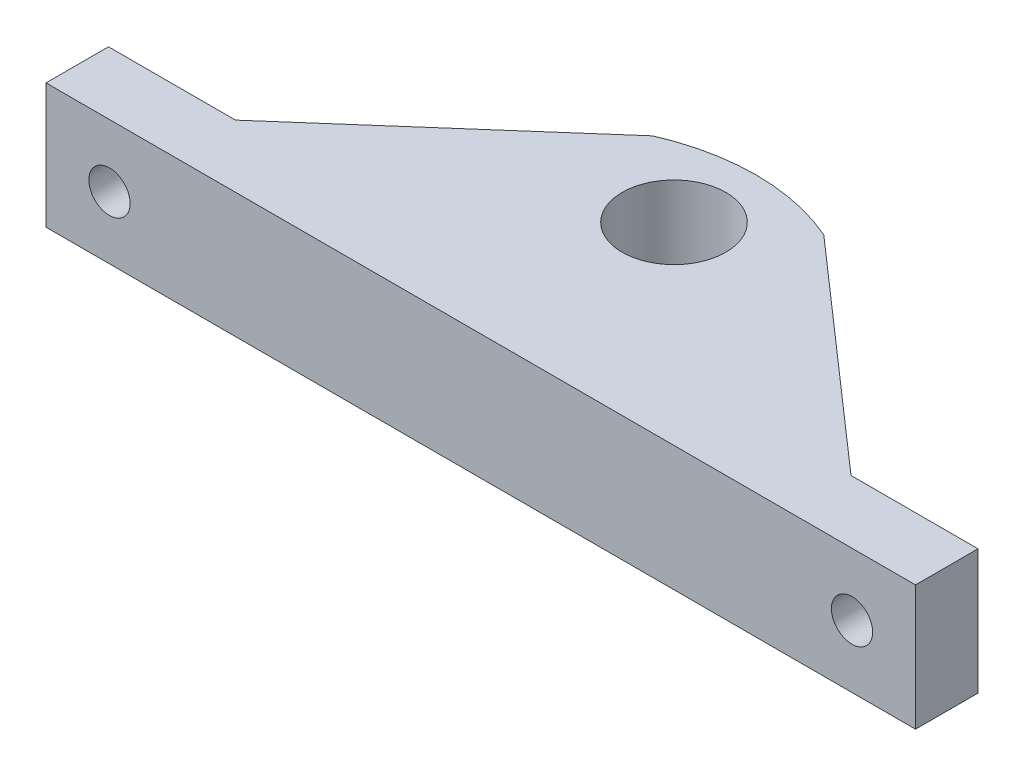
from build123d import *

# Parameters (mm, degrees)
SCHIZZO1_W                   = 69.56
SCHIZZO1_H                   = 10
ESTRUSIONE_ESTRUSIONE1_DEPTH = 5
SCHIZZO2_R                   = 4.15
ESTRUSIONE_ESTRUSIONE2_DEPTH = 10
SCHIZZO3_R                   = 1.65
TAGLIO_ESTRUSIONE1_DEPTH     = 5


with BuildPart() as part:
    # Schizzo1 → Estrusione-Estrusione1 (new body)
    with BuildSketch(Plane.XY):
        Rectangle(SCHIZZO1_W, SCHIZZO1_H)
    extrude(amount=ESTRUSIONE_ESTRUSIONE1_DEPTH)

    # Schizzo2 → Estrusione-Estrusione2 (add)
    with BuildSketch(Plane.XZ.offset(5)):
        with BuildLine():
            Line((24.621255453, 0), (-24.621255453, 0))
            Line((-24.621255453, 0), (-6.857549921, -15.584245975))
            ThreePointArc((-6.857549921, -15.584245975), (0, -17.026294768), (6.857549921, -15.584245975))
            Line((6.857549921, -15.584245975), (24.621255453, 0))
        make_face()
        with Locations(Location((0, -10.460161878, 0), (0, 0, 270))):
            Circle(SCHIZZO2_R, mode=Mode.SUBTRACT)
    extrude(amount=-ESTRUSIONE_ESTRUSIONE2_DEPTH)

    # Schizzo3 → Taglio-Estrusione1 (cut)
    with BuildSketch(Plane(origin=(0, 0, 0), x_dir=(-1, 0, 0), z_dir=(0, 0, -1))):
        with Locations((-29.700627727, 0)):
            Circle(SCHIZZO3_R)
    taglio_estrusione1 = extrude(amount=-TAGLIO_ESTRUSIONE1_DEPTH, mode=Mode.SUBTRACT)

    # Specchia1: Taglio-Estrusione1 across plane
    add(taglio_estrusione1.mirror(Plane(origin=(0, 0, 0), x_dir=(0, 0, 1), z_dir=(1, 0, 0))), mode=Mode.SUBTRACT)


solid = part.part
